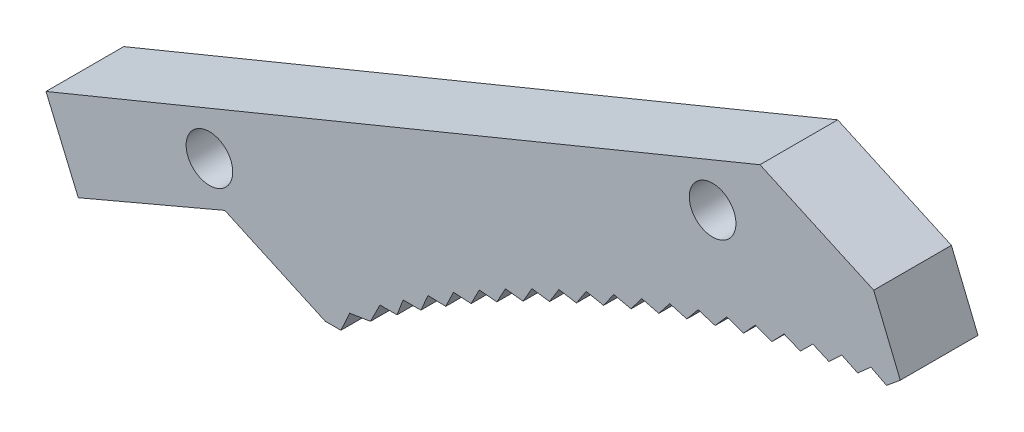
from build123d import *

# Parameters (mm, degrees)
SKETCH_1_R          = 1.5
EXTRUDE_1_DEPTH     = 5
CUT_EXTRUDE_1_DEPTH = 84.692683778


with BuildPart() as part:
    # 스케치1 → 보스-돌출1 (new body)
    with BuildSketch(Plane.XY):
        with BuildLine():
            Line((20.05, 5), (0, 5))
            ThreePointArc((0, 5), (-5, 0), (0, -5))
            Line((0, -5), (22, -5))
            Line((22, -5), (26.601353767, 1.956410875))
            Line((26.601353767, 1.956410875), (36.025134241, 5.963228766))
            Line((36.025134241, 5.963228766), (42.488975113, 3.018953392))
            Line((42.488975113, 3.018953392), (43.498164032, 3.018953392))
            Line((43.498164032, 3.018953392), (44.062133892, 4.253931713))
            Line((44.062133892, 4.253931713), (45.402427297, 4.470373499))
            Line((45.402427297, 4.470373499), (46.008680673, 5.685153438))
            Line((46.008680673, 5.685153438), (47.107948843, 5.685153438))
            Line((47.107948843, 5.685153438), (47.498446434, 6.712724429))
            Line((47.498446434, 6.712724429), (48.640951743, 6.712724429))
            Line((48.640951743, 6.712724429), (49.103035082, 7.757615508))
            Line((49.103035082, 7.757615508), (50.245112942, 7.726365831))
            Line((50.245112942, 7.726365831), (50.735603144, 8.758227131))
            Line((50.735603144, 8.758227131), (51.876398977, 8.69575116))
            Line((51.876398977, 8.69575116), (52.394929025, 9.713810574))
            Line((52.394929025, 9.713810574), (53.533589213, 9.620155058))
            Line((53.533589213, 9.620155058), (54.079771108, 10.623650806))
            Line((54.079771108, 10.623650806), (55.215443631, 10.498885825))
            Line((55.215443631, 10.498885825), (55.788868685, 11.487067026))
            Line((55.788868685, 11.487067026), (56.920703758, 11.331285936))
            Line((56.920703758, 11.331285936), (57.520942896, 12.303413169))
            Line((57.520942896, 12.303413169), (58.648093605, 12.116732536))
            Line((58.648093605, 12.116732536), (59.274697688, 13.072078391))
            Line((59.274697688, 13.072078391), (60.396320625, 12.854637901))
            Line((60.396320625, 12.854637901), (61.048820788, 13.792487525))
            Line((61.048820788, 13.792487525), (62.164076682, 13.544449883))
            Line((62.164076682, 13.544449883), (62.84198468, 14.464101515))
            Line((62.84198468, 14.464101515), (63.950039022, 14.185652318))
            Line((63.950039022, 14.185652318), (64.652847601, 15.086417815))
            Line((64.652847601, 15.086417815), (65.752871272, 14.777765417))
            Line((65.752871272, 14.777765417), (66.480054544, 15.658970767))
            Line((66.480054544, 15.658970767), (67.571224435, 15.320346122))
            Line((67.571224435, 15.320346122), (68.322238273, 16.181331949))
            Line((68.322238273, 16.181331949), (69.403737898, 15.812988438))
            Line((69.403737898, 15.812988438), (70.165521035, 16.650113087))
            Line((70.165521035, 16.650113087), (71.224188399, 16.249719983))
            Line((71.224188399, 16.249719983), (72.008283749, 17.065983242))
            Line((72.008283749, 17.065983242), (73.055761076, 16.637168043))
            Line((73.055761076, 16.637168043), (73.861597574, 17.431975419))
            Line((73.861597574, 17.431975419), (74.897121975, 16.975050435))
            Line((74.897121975, 16.975050435), (75.724112721, 17.74782306))
            Line((75.724112721, 17.74782306), (76.746930013, 17.263121075))
            Line((76.746930013, 17.263121075), (77.594472701, 18.013296132))
            Line((77.594472701, 18.013296132), (78.603837954, 17.501170159))
            Line((78.603837954, 17.501170159), (79.484104239, 18.229489901))
            Line((79.484104239, 18.229489901), (77.772918882, 22.391441928))
            Line((77.772918882, 22.391441928), (70.455863435, 25.724355994))
            Line((70.455863435, 25.724355994), (20.05, 5))
        make_face()
        with Locations((35.039512437, 8.36046215)):
            Circle(SKETCH_1_R, mode=Mode.SUBTRACT)
        Circle(SKETCH_1_R, mode=Mode.SUBTRACT)
        with Locations((22, 0)):
            Circle(SKETCH_1_R, mode=Mode.SUBTRACT)
        with Locations((67.410250422, 21.669681595)):
            Circle(SKETCH_1_R, mode=Mode.SUBTRACT)
    extrude(amount=EXTRUDE_1_DEPTH)

    # 스케치2 → 컷-돌출1 (cut, through all)
    with BuildSketch(Plane.XY.offset(5)):
        with BuildLine():
            Line((26.601353767, 1.956410875), (24.524988327, 6.83989014))
            Line((24.524988327, 6.83989014), (20.05, 5))
            Line((20.05, 5), (0, 5))
            ThreePointArc((0, 5), (-5, 0), (0, -5))
            Line((0, -5), (22, -5))
            Line((22, -5), (26.601353767, 1.956410875))
        make_face()
    extrude(amount=-CUT_EXTRUDE_1_DEPTH, mode=Mode.SUBTRACT)


solid = part.part
